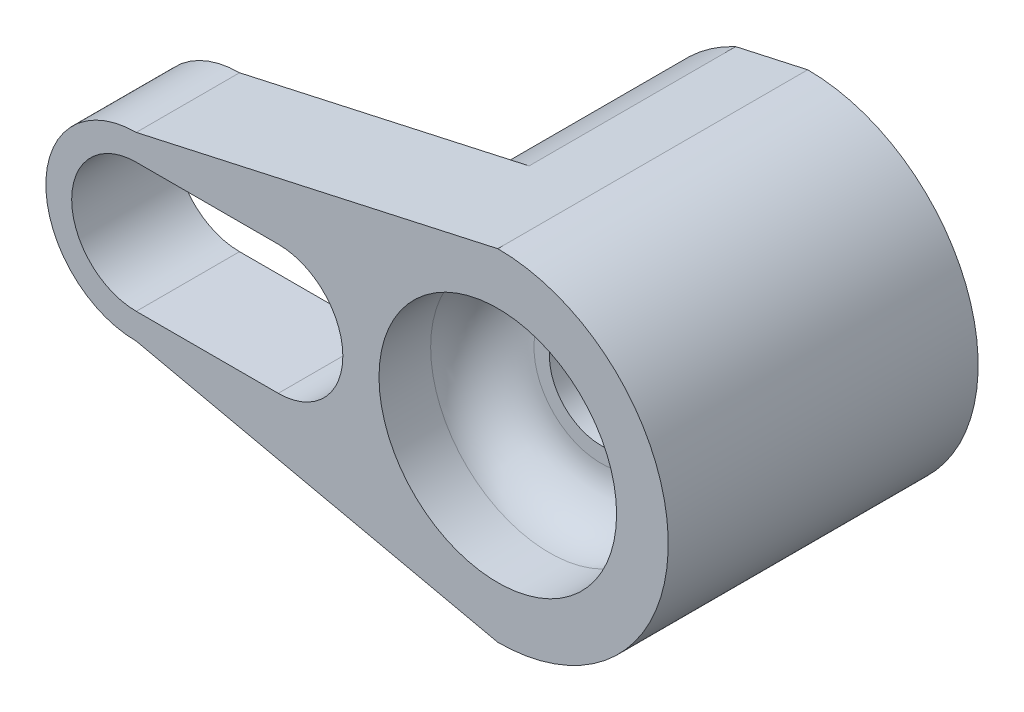
from build123d import *

# Parameters (mm, degrees)
SKIZZE1_R                       = 2.3
AUFSATZ_LINEAR_AUSTRAGEN1_DEPTH = 2
AUFSATZ_LINEAR_START            = -4
SKIZZE1_11_R                    = 2.3
AUFSATZ_LINEAR_AUSTRAGEN2_DEPTH = 4
AUFSATZ_LINEAR_START_2          = -2
SKIZZE1_13_R                    = 2.3
SKIZZE1_13_R_2                  = 1
AUFSATZ_LINEAR_AUSTRAGEN3_DEPTH = 2
VERRUNDUNG1_R                   = 1


with BuildPart() as part:
    # Skizze1 → Aufsatz-Linear austragen1 (new body)
    with BuildSketch(Plane.XY):
        with BuildLine():
            ThreePointArc((-7, 1.75), (-8.75, 0), (-7, -1.75))
            Line((-7, -1.75), (0, -3.3))
            ThreePointArc((0, -3.3), (3.3, 0), (0, 3.3))
            Line((0, 3.3), (-7, 1.75))
        make_face()
        with BuildLine():
            ThreePointArc((-4.25, 1.25), (-3, 0), (-4.25, -1.25))
            Line((-4.25, -1.25), (-7, -1.25))
            ThreePointArc((-7, -1.25), (-8.25, 0), (-7, 1.25))
            Line((-7, 1.25), (-4.25, 1.25))
        make_face(mode=Mode.SUBTRACT)
        Circle(SKIZZE1_R, mode=Mode.SUBTRACT)
    extrude(amount=AUFSATZ_LINEAR_AUSTRAGEN1_DEPTH)

    # Skizze1<11> → Aufsatz-Linear austragen2 (add)
    with BuildSketch(Plane.XY.offset(AUFSATZ_LINEAR_START)):
        with BuildLine():
            Line((0, 3.3), (-1.393122903, 2.991522786))
            ThreePointArc((-1.393122903, 2.991522786), (-2.57392942, 2.065160367), (-3.222352941, 0.711647049))
            ThreePointArc((-3.222352941, 0.711647049), (-3, 0), (-3.222352941, -0.711647049))
            ThreePointArc((-3.222352941, -0.711647049), (-2.57392942, -2.065160367), (-1.393122903, -2.991522786))
            Line((-1.393122903, -2.991522786), (0, -3.3))
            ThreePointArc((0, -3.3), (2.333452378, -2.333452378), (3.3, 0))
            ThreePointArc((3.3, 0), (2.333452378, 2.333452378), (0, 3.3))
        make_face()
        Circle(SKIZZE1_11_R, mode=Mode.SUBTRACT)
    extrude(amount=AUFSATZ_LINEAR_AUSTRAGEN2_DEPTH)

    # Skizze1<13> → Aufsatz-Linear austragen3 (add)
    with BuildSketch(Plane.XY.offset(AUFSATZ_LINEAR_START_2)):
        Circle(SKIZZE1_13_R)
        Circle(SKIZZE1_13_R_2, mode=Mode.SUBTRACT)
    extrude(amount=AUFSATZ_LINEAR_AUSTRAGEN3_DEPTH)

    # Verrundung1
    verrundung1_edges = [part.edges().sort_by_distance(p)[0] for p in [
        (-2.3, 0, 0),
    ]]
    fillet(verrundung1_edges, radius=VERRUNDUNG1_R)


solid = part.part
